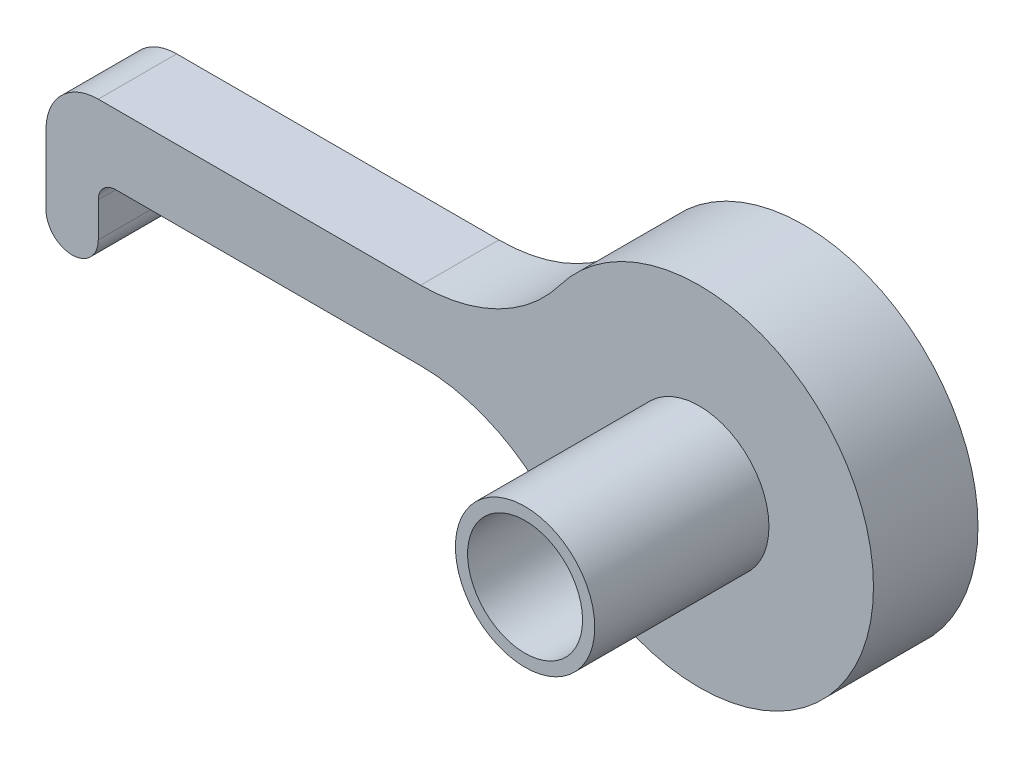
from build123d import *

# Parameters (mm, degrees)
ESBO_O1_R                = 10
RESSALTO_EXTRUS_O1_DEPTH = 6
RESSALTO_EXTRUS_O2_START = -4.5
RESSALTO_EXTRUS_O2_DEPTH = 4.5
FILETE1_R                = 3
FILETE2_R                = 1
FILETE3_R                = 10
ESBO_O3_R                = 4
RESSALTO_EXTRUS_O3_DEPTH = 10
ESBO_O4_R                = 3.3
CORTE_EXTRUS_O1_DEPTH    = 14


with BuildPart() as part:
    # Esboço1 → Ressalto-extrusão1 (new body)
    with BuildSketch(Plane.XY):
        Circle(ESBO_O1_R)
    extrude(amount=RESSALTO_EXTRUS_O1_DEPTH)

    # Esboço2 → Ressalto-extrusão2 (add)
    with BuildSketch(Plane.XY.offset(6).offset(RESSALTO_EXTRUS_O2_START)):
        with BuildLine():
            Line((-9.797958971, 2), (-37.5, 2))
            Line((-37.5, 2), (-37.5, -5))
            ThreePointArc((-37.5, -5), (-36, -6.5), (-34.5, -5))
            Line((-34.5, -5), (-34.5, -2))
            Line((-34.5, -2), (-9.797958971, -2))
            ThreePointArc((-9.797958971, -2), (-10, 0), (-9.797958971, 2))
        make_face()
    extrude(amount=RESSALTO_EXTRUS_O2_DEPTH)

    # Filete1
    filete1_edges = [part.edges().sort_by_distance(p)[0] for p in [
        (-37.5, 2, 3.75),
    ]]
    fillet(filete1_edges, radius=FILETE1_R)

    # Filete2
    filete2_edges = [part.edges().sort_by_distance(p)[0] for p in [
        (-34.5, -2, 3.75),
    ]]
    fillet(filete2_edges, radius=FILETE2_R)

    # Filete3
    filete3_edges = [part.edges().sort_by_distance(p)[0] for p in [
        (-9.797958971, 2, 3.75),
        (-9.797958971, -2, 3.75),
    ]]
    fillet(filete3_edges, radius=FILETE3_R)

    # Esboço3 → Ressalto-extrusão3 (add)
    with BuildSketch(Plane.XY.offset(6)):
        Circle(ESBO_O3_R)
    extrude(amount=RESSALTO_EXTRUS_O3_DEPTH)

    # Esboço4 → Corte-extrusão1 (cut)
    with BuildSketch(Plane.XY.offset(16)):
        Circle(ESBO_O4_R)
    extrude(amount=-CORTE_EXTRUS_O1_DEPTH, mode=Mode.SUBTRACT)


solid = part.part
